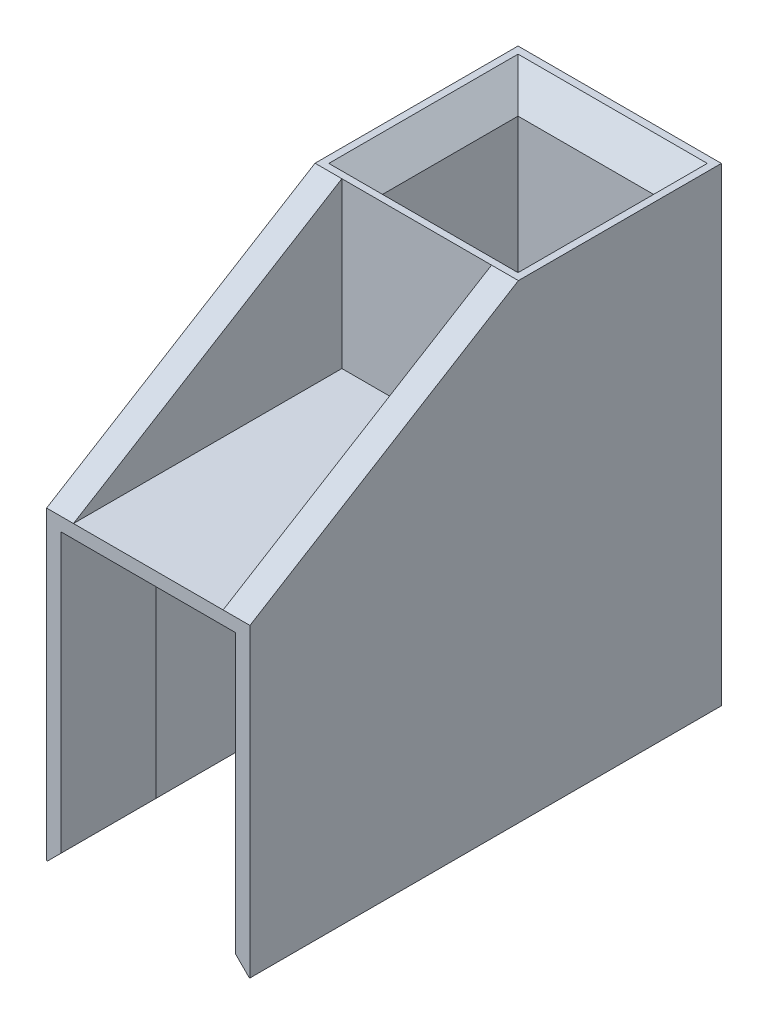
from build123d import *

# Parameters (mm, degrees)
CROQUIS2_W              = 30.3
CROQUIS2_H              = 70
SALIENTE_EXTRUIR2_DEPTH = 5
SALIENTE_EXTRUIR3_START = -20
SALIENTE_EXTRUIR3_DEPTH = 70
SALIENTE_EXTRUIR4_START = -20
CROQUIS4_W              = 20.2
CROQUIS4_H              = 20.2
SALIENTE_EXTRUIR4_DEPTH = 4
CHAFL_N4_SIZE           = 4
CROQUIS6_W              = 30.3
CROQUIS6_H              = 5
CROQUIS6_W_2            = 5.125
CROQUIS6_H_2            = 40.5
SALIENTE_EXTRUIR6_DEPTH = 40
SALIENTE_EXTRUIR7_START = -15.15
SALIENTE_EXTRUIR7_DEPTH = 30.3
CROQUIS8_W              = 22.3
CROQUIS8_H              = 24.5
CORTAR_EXTRUIR1_DEPTH   = 40
CHAFL_N7_SIZE           = 3
CHAFL_N7_SIZE2          = 11.196152423
CHAFL_N9_SIZE           = 5


with BuildPart() as part:
    # Croquis2 → Saliente-Extruir2 (new body)
    with BuildSketch(Plane.XY):
        with Locations((0, 15)):
            Rectangle(CROQUIS2_W, CROQUIS2_H)
    extrude(amount=-SALIENTE_EXTRUIR2_DEPTH)

    # Croquis3 → Saliente-Extruir3 (add)
    with BuildSketch(Plane(origin=(0, 0, 0), x_dir=(1, 0, 0), z_dir=(0, 1, 0)).offset(SALIENTE_EXTRUIR3_START)):
        Polygon((-15.15, 30.25), (-15.15, 5), (-10.1, 5), (-10.1, 25.2), (10.1, 25.2), (10.1, 5), (15.15, 5), (15.15, 30.25), align=None)
    extrude(amount=SALIENTE_EXTRUIR3_DEPTH)

    # Croquis4 → Saliente-Extruir4 (add)
    with BuildSketch(Plane(origin=(0, 0, 0), x_dir=(1, 0, 0), z_dir=(0, 1, 0)).offset(SALIENTE_EXTRUIR4_START)):
        with Locations((0, 15.1)):
            Rectangle(CROQUIS4_W, CROQUIS4_H)
    extrude(amount=SALIENTE_EXTRUIR4_DEPTH)

    # Chaflán4
    chafl_n4_edges = [part.edges().sort_by_distance(p)[0] for p in [
        (0, 50, -5),
        (10.1, 50, -15.1),
        (0, 50, -25.2),
        (-10.1, 50, -15.1),
    ]]
    chamfer(chafl_n4_edges, length=CHAFL_N4_SIZE)

    # Croquis6 → Saliente-Extruir6 (add)
    with BuildSketch(Plane.XY):
        with Locations((0, 23)):
            Rectangle(CROQUIS6_W, CROQUIS6_H)
        with Locations((-12.5875, 0.25)):
            Rectangle(CROQUIS6_W_2, CROQUIS6_H_2)
        with Locations((12.5875, 0.25)):
            Rectangle(CROQUIS6_W_2, CROQUIS6_H_2)
    extrude(amount=SALIENTE_EXTRUIR6_DEPTH)

    # Croquis7 → Saliente-Extruir7 (add)
    with BuildSketch(Plane(origin=(0, 0, 0), x_dir=(0, 0, -1), z_dir=(1, 0, 0)).offset(SALIENTE_EXTRUIR7_START)):
        Polygon((-40, 25.5), (0, 50), (0, 25.5), align=None)
    extrude(amount=SALIENTE_EXTRUIR7_DEPTH)

    # Croquis8 → Cortar-Extruir1 (cut)
    with BuildSketch(Plane.XY):
        with Locations((0, 37.75)):
            Rectangle(CROQUIS8_W, CROQUIS8_H)
    extrude(amount=CORTAR_EXTRUIR1_DEPTH, mode=Mode.SUBTRACT)

    # Chaflán7
    chafl_n7_edges = [part.edges().sort_by_distance(p)[0] for p in [
        (-10.025, 0.25, 40),
        (0, 20.5, 40),
        (10.025, 0.25, 40),
    ]]
    chafl_n7_side = [part.faces().sort_by_distance(p)[0] for p in [
        (14.603342886, 2.75, 40),
    ]]
    chamfer(chafl_n7_edges, length=CHAFL_N7_SIZE, length2=CHAFL_N7_SIZE2, reference=chafl_n7_side[0])

    # Chaflán9
    chafl_n9_edges = [part.edges().sort_by_distance(p)[0] for p in [
        (10.025, -20, 14.401923789),
        (-10.025, -20, 14.401923789),
    ]]
    chamfer(chafl_n9_edges, length=CHAFL_N9_SIZE)


solid = part.part
